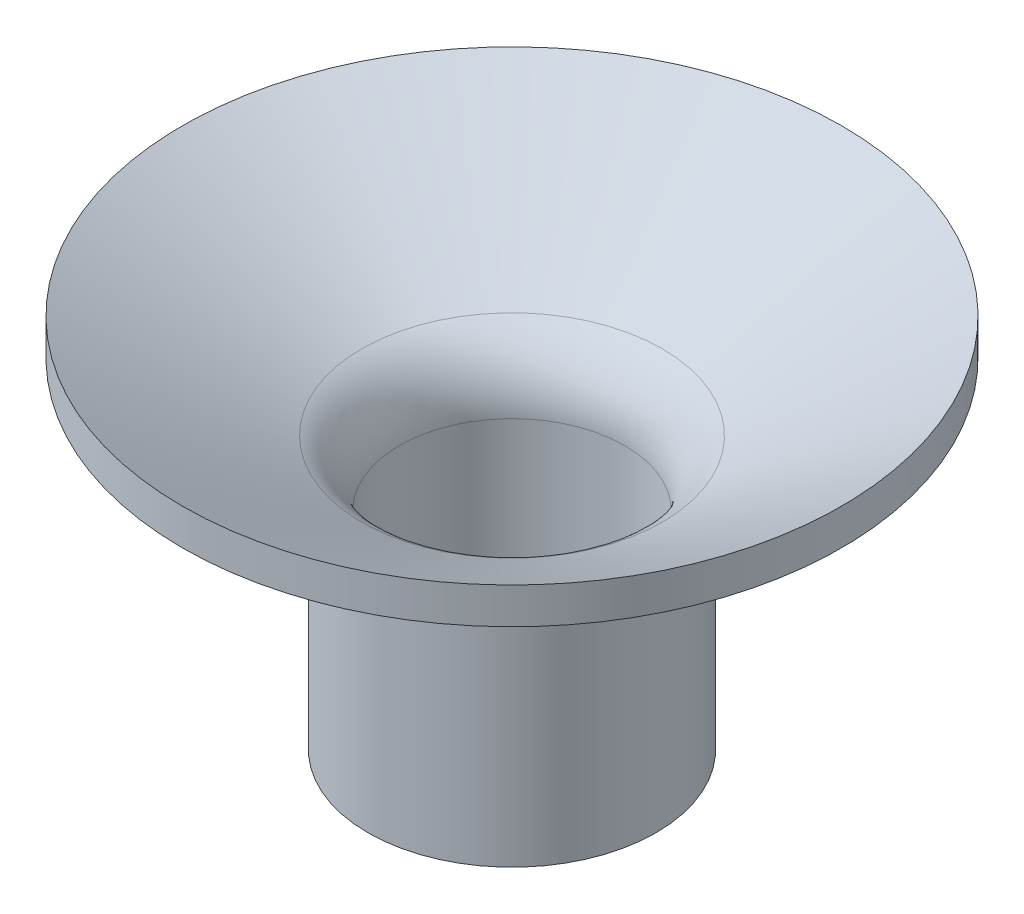
from build123d import *

# Parameters (mm, degrees)
FILLET1_R = 6


with BuildPart() as part:
    # Sketch1 → Revolve1 (revolve)
    with BuildSketch(Plane(origin=(0, 0, 0), x_dir=(0, 0, -1), z_dir=(1, 0, 0))):
        Polygon((-9, 0), (-9, 20), (-26.320508076, 30), (-26.320508076, 27.113248654), (-11.5, 18.556624327), (-11.5, 0), align=None)
    revolve(axis=Axis((0, 0, 0), (0, 1, 0)))

    # Fillet1
    fillet1_edges = [part.edges().sort_by_distance(p)[0] for p in [
        (0, 20, -9),
    ]]
    fillet(fillet1_edges, radius=FILLET1_R)


solid = part.part
